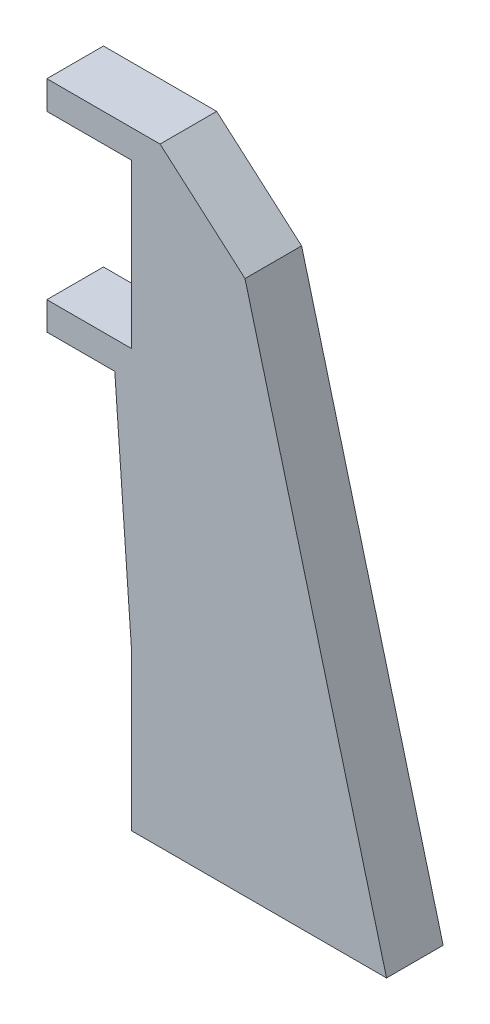
from build123d import *

# Parameters (mm, degrees)
BOSS_EXTRUDE1_DEPTH = 25.4


with BuildPart() as part:
    # Sketch1 → Boss-Extrude1 (new body)
    with BuildSketch(Plane.XY):
        Polygon((0, 0), (0, 12.7), (50.8, 12.7), (88.9, -20.510228633), (152.4, -260.515926793), (38.018659419, -260.515926793), (38.018659419, -190.696503564), (30.48, -85.763926793), (0, -85.763926793), (0, -73.152260366), (38.018659419, -73.152260366), (38.018659419, 0), align=None)
    extrude(amount=BOSS_EXTRUDE1_DEPTH)


solid = part.part
